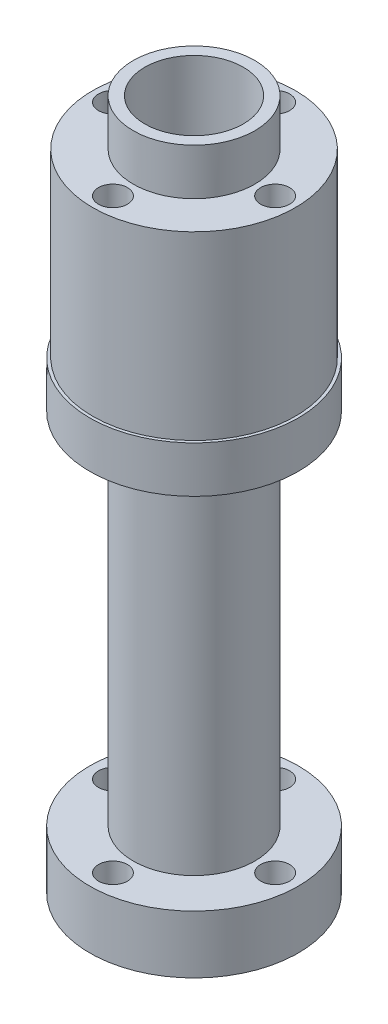
from build123d import *

# Parameters (mm, degrees)
SKETCH_2_R          = 1.25
CUT_EXTRUDE_1_DEPTH = 10
CUT_EXTRUDE_START   = -49.6
SKETCH_2_2_R        = 1.25
CUT_EXTRUDE_2_DEPTH = 6
SKETCH_3_OUTSIDE_W  = 32.23
SKETCH_3_OUTSIDE_H  = 32.23
SKETCH_3_OUTSIDE_R  = 8.75
CUT_EXTRUDE_3_DEPTH = 15.6
SKETCH_4_R          = 5.25
SKETCH_4_R_2        = 4.25
EXTRUDE_1_DEPTH     = 4


with BuildPart() as part:
    # 草图1 → 旋转1 (revolve)
    with BuildSketch(Plane.XY, mode=Mode.PRIVATE) as revolve_1_sk:
        Polygon((-9, 36), (-5.25, 36), (-5.25, 5), (-9, 5), (-9, 0), (-4.25, 0), (-4.25, 55.6), (-9, 55.6), align=None)
    revolve(revolve_1_sk.sketch.rotate(Axis((0, 0, 0), (0, 1, 0)), 270), axis=Axis((0, 0, 0), (0, 1, 0)))

    # 草图2 → 切除-拉伸1 (cut)
    with BuildSketch(Plane(origin=(0, 55.6, 0), x_dir=(1, 0, 0), z_dir=(0, 1, 0))):
        with Locations(Location((0, 7, 0), (0, 0, 270))):
            Circle(SKETCH_2_R)
        with Locations(Location((0, -7, 0), (0, 0, 270))):
            Circle(SKETCH_2_R)
        with Locations(Location((-7, 0, 0), (0, 0, 270))):
            Circle(SKETCH_2_R)
        with Locations(Location((7, 0, 0), (0, 0, 270))):
            Circle(SKETCH_2_R)
    extrude(amount=-CUT_EXTRUDE_1_DEPTH, mode=Mode.SUBTRACT)

    # 草图2<2> → 切除-拉伸2 (cut)
    with BuildSketch(Plane(origin=(0, 55.6, 0), x_dir=(1, 0, 0), z_dir=(0, 1, 0)).offset(CUT_EXTRUDE_START)):
        with Locations(Location((0, 7, 0), (0, 0, 270))):
            Circle(SKETCH_2_2_R)
        with Locations(Location((0, -7, 0), (0, 0, 270))):
            Circle(SKETCH_2_2_R)
        with Locations(Location((-7, 0, 0), (0, 0, 270))):
            Circle(SKETCH_2_2_R)
        with Locations(Location((7, 0, 0), (0, 0, 270))):
            Circle(SKETCH_2_2_R)
    extrude(amount=-CUT_EXTRUDE_2_DEPTH, mode=Mode.SUBTRACT)

    # 草图3 outside → 切除-拉伸3 (cut)
    with BuildSketch(Plane(origin=(0, 55.6, 0), x_dir=(1, 0, 0), z_dir=(0, 1, 0))):
        Rectangle(SKETCH_3_OUTSIDE_W, SKETCH_3_OUTSIDE_H)
        with Locations(Location((0, 0, 0), (0, 0, 270))):
            Circle(SKETCH_3_OUTSIDE_R, mode=Mode.SUBTRACT)
    extrude(amount=-CUT_EXTRUDE_3_DEPTH, mode=Mode.SUBTRACT)

    # 草图4 → 凸台-拉伸1 (add)
    with BuildSketch(Plane(origin=(0, 55.6, 0), x_dir=(1, 0, 0), z_dir=(0, 1, 0))):
        with Locations(Location((0, 0, 0), (0, 0, 90))):
            Circle(SKETCH_4_R)
        with Locations(Location((0, 0, 0), (0, 0, 90))):
            Circle(SKETCH_4_R_2, mode=Mode.SUBTRACT)
    extrude(amount=EXTRUDE_1_DEPTH)


solid = part.part
